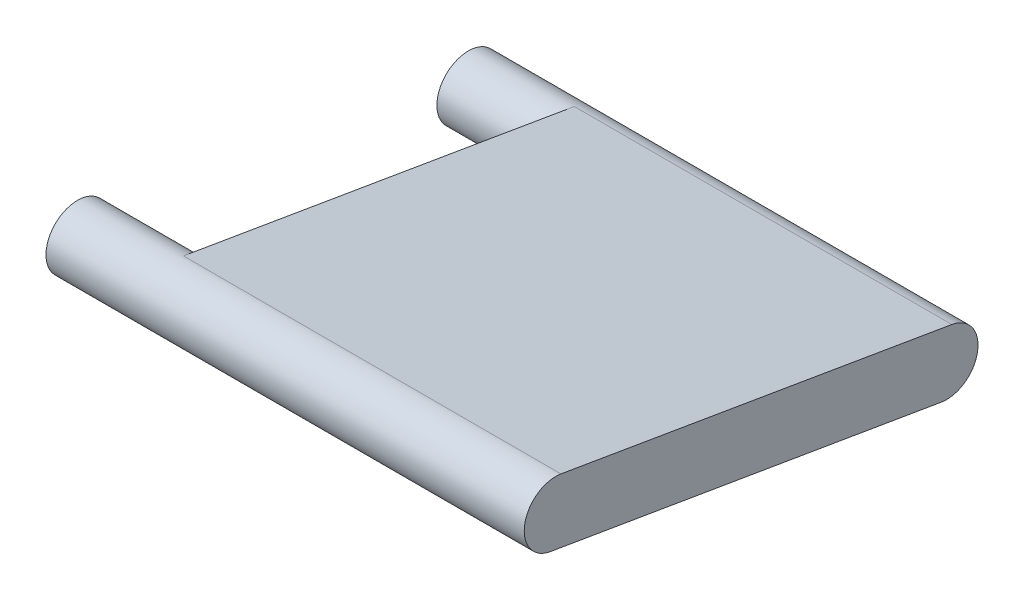
from build123d import *

# Parameters (mm, degrees)
BOSS_EXTRUDE1_DEPTH = 38.1
BOSS_EXTRUDE2_START = 10.16
SKETCH2_R           = 3.175
BOSS_EXTRUDE2_DEPTH = 10.16


with BuildPart() as part:
    # Sketch1 → Boss-Extrude1 (new body)
    with BuildSketch(Plane(origin=(0, 0, 0), x_dir=(0, 0, -1), z_dir=(1, 0, 0))):
        with BuildLine():
            Line((0.528916607, 3.130634476), (39.974911006, -3.533714773))
            ThreePointArc((39.974911006, -3.533714773), (42.576628875, -7.193265857), (38.917077791, -9.794983726))
            Line((38.917077791, -9.794983726), (-0.528916607, -3.130634476))
            ThreePointArc((-0.528916607, -3.130634476), (-3.130634476, 0.528916607), (0.528916607, 3.130634476))
        make_face()
    extrude(amount=BOSS_EXTRUDE1_DEPTH)

    # Sketch2 → Boss-Extrude2 (add)
    with BuildSketch(Plane.ZY.offset(BOSS_EXTRUDE2_START)):
        with Locations((-39.445994398, -6.664349249)):
            Circle(SKETCH2_R)
        Circle(SKETCH2_R)
    extrude(amount=-BOSS_EXTRUDE2_DEPTH)


solid = part.part
